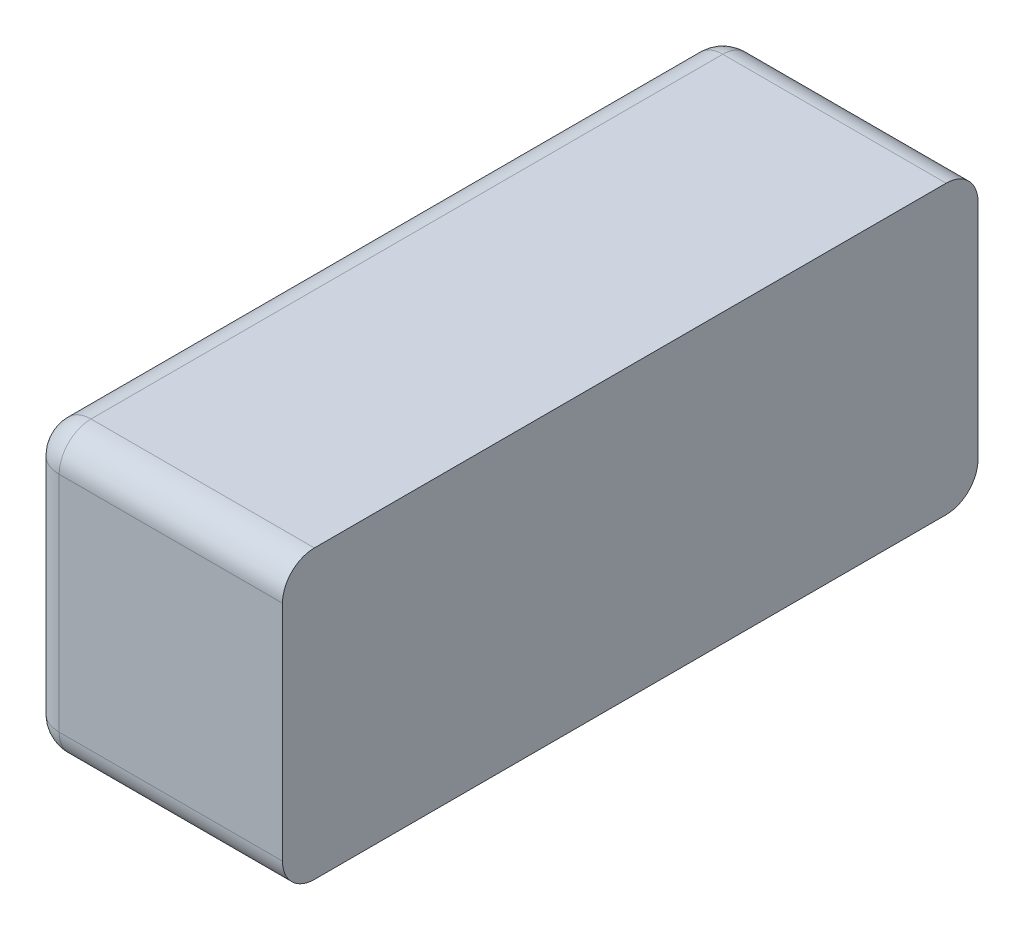
from build123d import *

# Parameters (mm, degrees)
SKETCH_1_W             = 40
SKETCH_1_H             = 45
EXTRUDE_80_70_70_DEPTH = 109
FILLET_2_R             = 5


with BuildPart() as part:
    # 草图1 → 80横向_70纵向_70竖向 (new body)
    with BuildSketch(Plane.XY):
        with Locations((-5.714285714, 0)):
            Rectangle(SKETCH_1_W, SKETCH_1_H)
    extrude(amount=EXTRUDE_80_70_70_DEPTH)

    # 圆角2
    fillet_2_edges = [part.edges().sort_by_distance(p)[0] for p in [
        (-5.714285714, 22.5, 109),
        (-25.714285714, 0, 109),
        (-5.714285714, 22.5, 0),
        (-5.714285714, -22.5, 0),
        (-25.714285714, 0, 0),
        (-25.714285714, 22.5, 54.5),
        (-25.714285714, -22.5, 54.5),
        (-5.714285714, -22.5, 109),
    ]]
    fillet(fillet_2_edges, radius=FILLET_2_R)


solid = part.part
